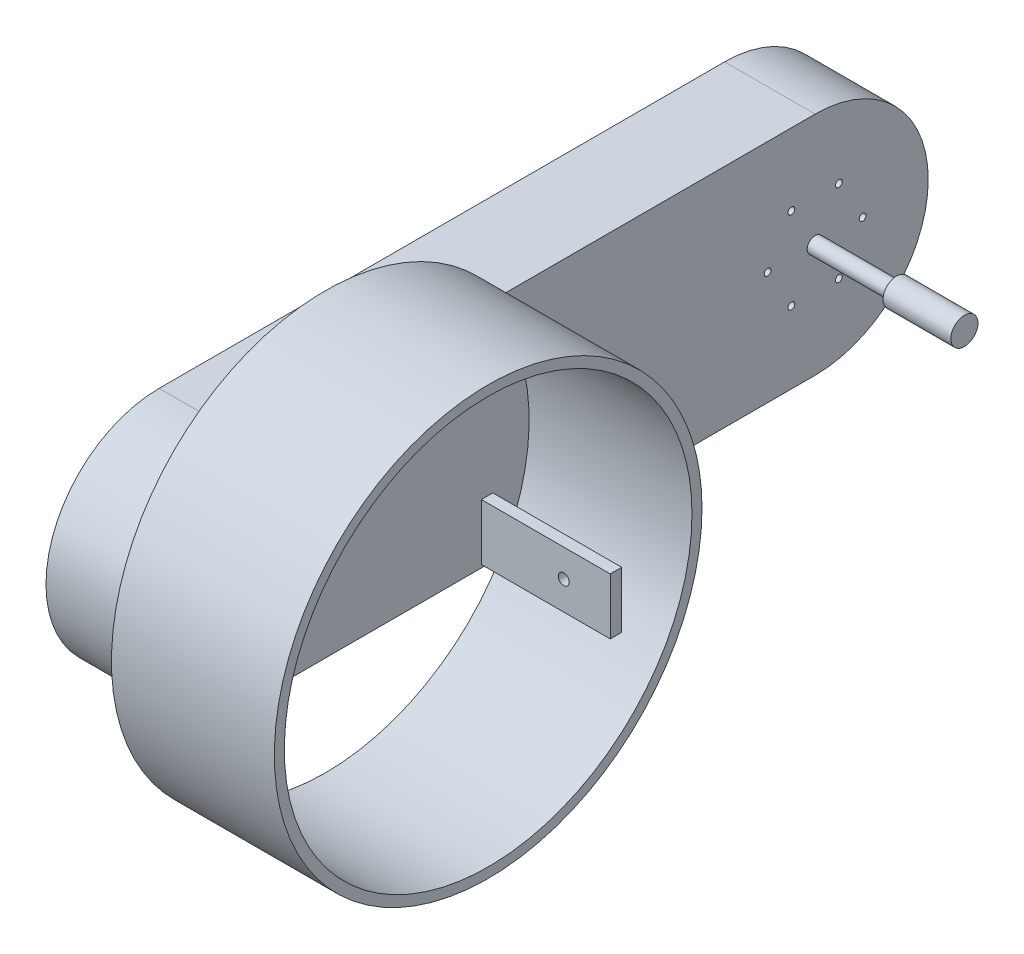
from build123d import *

# Parameters (mm, degrees)
BOSS_EXTRUDE1_DEPTH = 40
SHELL1_T            = -4
SKETCH4_R           = 1.5
CUT_EXTRUDE1_DEPTH  = 40
SKETCH6_R           = 3.5
BOSS_EXTRUDE2_DEPTH = 40
SKETCH7_R           = 6
BOSS_EXTRUDE3_DEPTH = 30
SKETCH11_R          = 7.621273112
CUT_EXTRUDE2_DEPTH  = 10
SKETCH14_W          = 5.073937662
SKETCH14_H          = 24.893505848
BOSS_EXTRUDE5_DEPTH = 57
SKETCH15_R          = 2.42948244
CUT_EXTRUDE4_DEPTH  = 57
SKETCH18_R          = 94.524667443
SKETCH18_R_2        = 90.107612794
BOSS_EXTRUDE7_DEPTH = 72


with BuildPart() as part:
    # Sketch2 → Boss-Extrude1 (new body)
    with BuildSketch(Plane(origin=(0, 0, 0), x_dir=(0, 0, -1), z_dir=(1, 0, 0))):
        with BuildLine():
            ThreePointArc((42.291021672, 3.859649123), (27.646360731, -31.495689937), (-7.708978328, -46.140350877))
            Line((-7.708978328, -46.140350877), (242.291021672, -46.140350877))
            ThreePointArc((242.291021672, -46.140350877), (192.291021672, 3.859649123), (242.291021672, 53.859649123))
            Line((242.291021672, 53.859649123), (-7.708978328, 53.859649123))
            ThreePointArc((-7.708978328, 53.859649123), (27.646360731, 39.214988182), (42.291021672, 3.859649123))
        make_face()
        with BuildLine():
            ThreePointArc((-7.708978328, 53.859649123), (-57.708978328, 3.859649123), (-7.708978328, -46.140350877))
            Line((-7.708978328, -46.140350877), (-7.708978328, 53.859649123))
        make_face()
        with BuildLine():
            Line((-7.708978328, 53.859649123), (-7.708978328, -46.140350877))
            ThreePointArc((-7.708978328, -46.140350877), (27.646360731, -31.495689937), (42.291021672, 3.859649123))
            ThreePointArc((42.291021672, 3.859649123), (27.646360731, 39.214988182), (-7.708978328, 53.859649123))
        make_face()
        with BuildLine():
            ThreePointArc((242.291021672, 53.859649123), (192.291021672, 3.859649123), (242.291021672, -46.140350877))
            Line((242.291021672, -46.140350877), (242.291021672, 53.859649123))
        make_face()
        with BuildLine():
            Line((242.291021672, 53.859649123), (242.291021672, -46.140350877))
            ThreePointArc((242.291021672, -46.140350877), (277.646360731, -31.495689937), (292.291021672, 3.859649123))
            ThreePointArc((292.291021672, 3.859649123), (277.646360731, 39.214988182), (242.291021672, 53.859649123))
        make_face()
    extrude(amount=BOSS_EXTRUDE1_DEPTH)

    # Shell1
    shell1_openings = [part.faces().sort_by_distance(p)[0] for p in [
        (0, 3.859649123, -117.291021672),
    ]]
    offset(amount=SHELL1_T, openings=shell1_openings, kind=Kind.INTERSECTION)

    # Sketch4 → Cut-Extrude1 (cut)
    with BuildSketch(Plane.ZY.offset(-36)):
        with Locations((-252.791021672, 22.046182602)):
            Circle(SKETCH4_R)
        with Locations((-231.791021672, 22.046182602)):
            Circle(SKETCH4_R)
        with Locations((-263.291021672, 3.859649123)):
            Circle(SKETCH4_R)
        with Locations((-221.291021672, 3.859649123)):
            Circle(SKETCH4_R)
        with Locations((-252.791021672, -14.326884357)):
            Circle(SKETCH4_R)
        with Locations((-231.791021672, -14.326884357)):
            Circle(SKETCH4_R)
    extrude(amount=-CUT_EXTRUDE1_DEPTH, mode=Mode.SUBTRACT)

    # Sketch6 → Boss-Extrude2 (add)
    with BuildSketch(Plane.ZY.offset(-36)):
        with Locations((-242.291021672, 3.859649123)):
            Circle(SKETCH6_R)
    extrude(amount=-BOSS_EXTRUDE2_DEPTH)

    # Sketch7 → Boss-Extrude3 (add)
    with BuildSketch(Plane(origin=(76, 0, 0), x_dir=(0, 0, -1), z_dir=(1, 0, 0))):
        with Locations((242.291021672, 3.859649123)):
            Circle(SKETCH7_R)
    extrude(amount=BOSS_EXTRUDE3_DEPTH)

    # Sketch11 → Cut-Extrude2 (cut)
    with BuildSketch(Plane(origin=(40, 0, 0), x_dir=(0, 0, -1), z_dir=(1, 0, 0))):
        Circle(SKETCH11_R)
    extrude(amount=-CUT_EXTRUDE2_DEPTH, mode=Mode.SUBTRACT)

    # Sketch14 → Boss-Extrude5 (add)
    with BuildSketch(Plane(origin=(40, 0, 0), x_dir=(0, 0, -1), z_dir=(1, 0, 0))):
        with Locations((97.267454621, -32.353135016)):
            Rectangle(SKETCH14_W, SKETCH14_H)
    extrude(amount=BOSS_EXTRUDE5_DEPTH)

    # Sketch15 → Cut-Extrude4 (cut)
    with BuildSketch(Plane(origin=(0, 0, -99.804423452), x_dir=(-1, 0, 0), z_dir=(0, 0, -1))):
        with Locations((-76.430932939, -32.204980858)):
            Circle(SKETCH15_R)
    extrude(amount=-CUT_EXTRUDE4_DEPTH, mode=Mode.SUBTRACT)

    # Sketch18 → Boss-Extrude7 (add)
    with BuildSketch(Plane(origin=(40, 0, 0), x_dir=(0, 0, -1), z_dir=(1, 0, 0))):
        with Locations(Location((25.75, 0, 0), (0, 0, 34.735906814))):
            Circle(SKETCH18_R)
        with Locations(Location((25.75, 0, 0), (0, 0, 36.707196429))):
            Circle(SKETCH18_R_2, mode=Mode.SUBTRACT)
    extrude(amount=BOSS_EXTRUDE7_DEPTH)


solid = part.part
